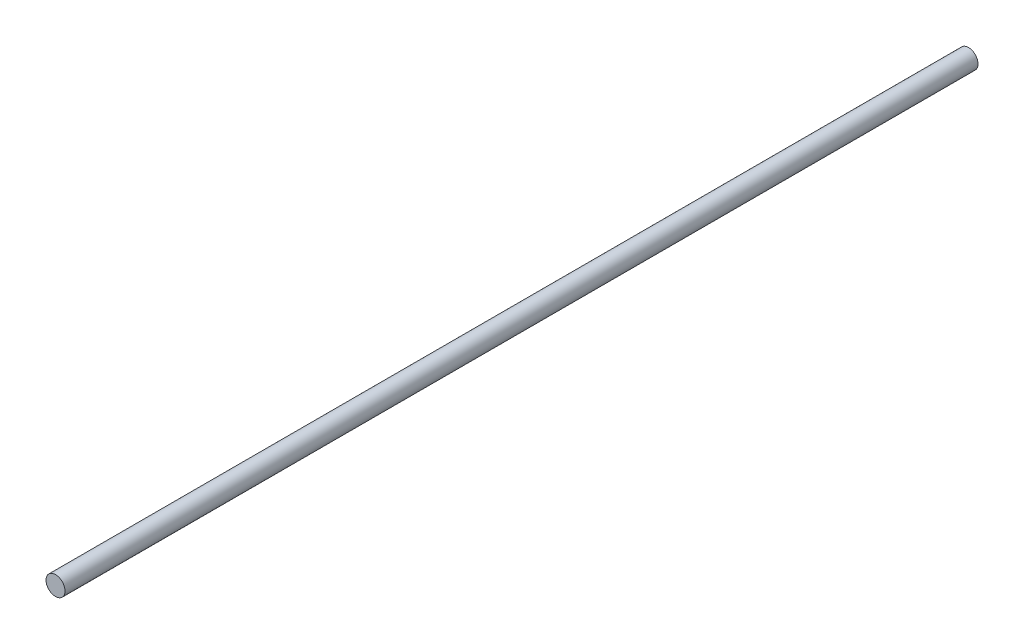
from build123d import *

# Parameters (mm, degrees)
SKETCH1_R           = 3.175
BOSS_EXTRUDE1_DEPTH = 152.4


with BuildPart() as part:
    # Sketch1 → Boss-Extrude1 (new, symmetric)
    with BuildSketch(Plane.XY):
        with Locations(Location((0, 0, 0), (0, 0, 180))):
            Circle(SKETCH1_R)
    extrude(amount=BOSS_EXTRUDE1_DEPTH, both=True)


solid = part.part
